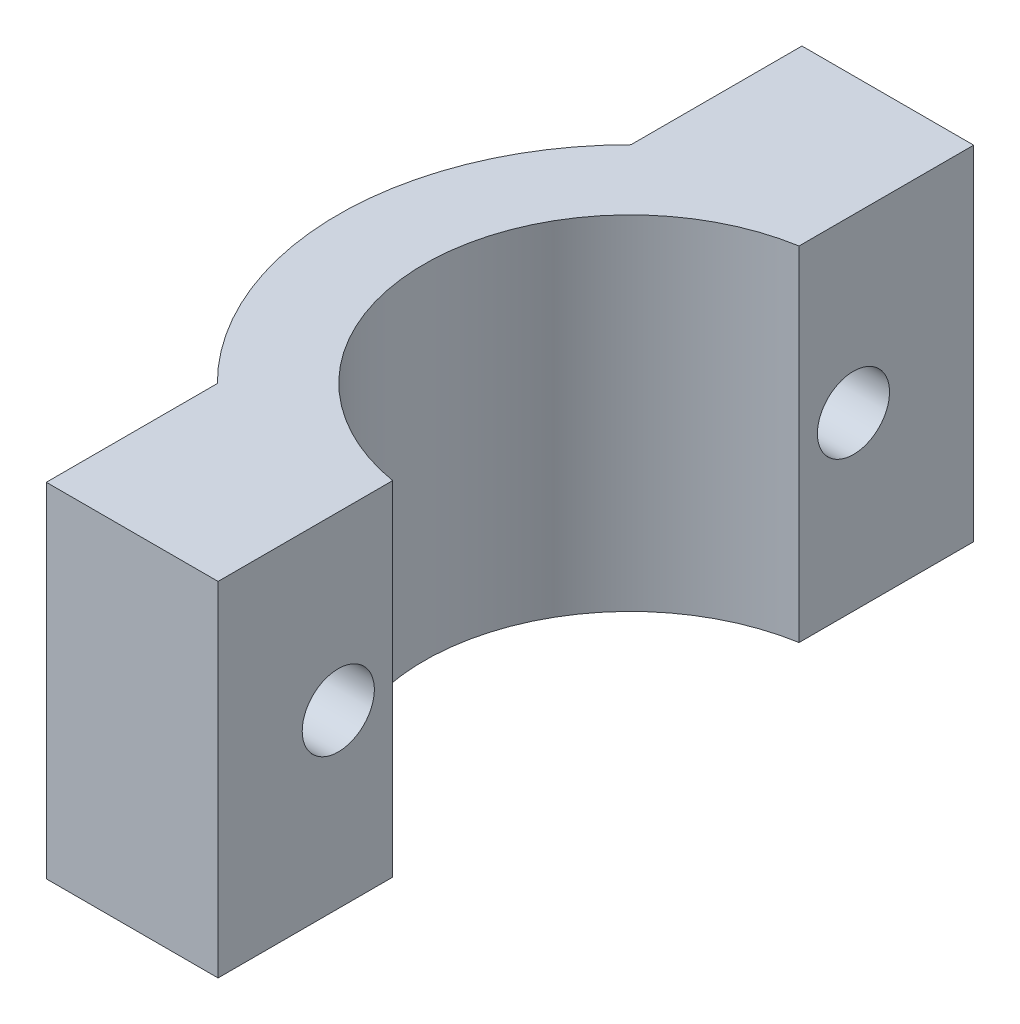
from build123d import *

# Parameters (mm, degrees)
BOSS_EXTRUDE1_DEPTH     = 10
CUT_EXTRUDE1_DEPTH      = 18.12454379
CUT_EXTRUDE1_DEPTH_BACK = 18.12454379
SKETCH2_R               = 1.05
CUT_EXTRUDE2_DEPTH      = 1
CUT_EXTRUDE2_DEPTH_BACK = 10
CUT_EXTRUDE2_START      = -6
SKETCH2_3_R             = 1.75
SKETCH2_3_R_2           = 1.05


with BuildPart() as part:
    # Sketch1 → Boss-Extrude1 (new body)
    with BuildSketch(Plane(origin=(0, 0, 0), x_dir=(1, 0, 0), z_dir=(0, 1, 0))):
        with BuildLine():
            Line((-6, -2.1e-08), (-6, 6.020797289))
            ThreePointArc((-6, 6.020797289), (-8.5, 0), (-6, -6.020797289))
            Line((-6, -6.020797289), (-6, -2.1e-08))
        make_face()
        with BuildLine():
            ThreePointArc((-1, 8.440971508), (-3.703283788, 7.65086199), (-6, 6.020797289))
            Line((-6, 6.020797289), (-6, -2.1e-08))
            ThreePointArc((-6, -2.1e-08), (-4.582575702, 3.872983338), (-1, 5.916079783))
            Line((-1, 5.916079783), (-1, 8.440971508))
        make_face()
        with BuildLine():
            ThreePointArc((-1, -5.916079783), (-4.582575688, -3.872983354), (-6, -2.1e-08))
            Line((-6, -2.1e-08), (-6, -6.020797289))
            ThreePointArc((-6, -6.020797289), (-3.703283788, -7.65086199), (-1, -8.440971508))
            Line((-1, -8.440971508), (-1, -5.916079783))
        make_face()
        with BuildLine():
            ThreePointArc((-1, -8.440971508), (-3.703283788, -7.65086199), (-6, -6.020797289))
            Line((-6, -6.020797289), (-6, -11))
            Line((-6, -11), (-1, -11))
            Line((-1, -11), (-1, -8.440971508))
        make_face()
        with BuildLine():
            Line((-1, 11), (-6, 11))
            Line((-6, 11), (-6, 6.020797289))
            ThreePointArc((-6, 6.020797289), (-3.703283788, 7.65086199), (-1, 8.440971508))
            Line((-1, 8.440971508), (-1, 11))
        make_face()
    extrude(amount=-BOSS_EXTRUDE1_DEPTH)

    # Sketch2 → Cut-Extrude1 (cut, two sides: drawn at the far end of the back side and taken through both)
    with BuildSketch(Plane(origin=(0, 0, 0), x_dir=(0, 0, -1), z_dir=(1, 0, 0)).offset(-CUT_EXTRUDE1_DEPTH_BACK)):
        with Locations(Location((-7.5, -5, 0), (0, 0, 180))):
            Circle(SKETCH2_R)
        with Locations(Location((7.5, -5, 0), (0, 0, 180))):
            Circle(SKETCH2_R)
    extrude(amount=CUT_EXTRUDE1_DEPTH + CUT_EXTRUDE1_DEPTH_BACK, mode=Mode.SUBTRACT)

    # Sketch2<3> → Cut-Extrude2 (cut, two sides: drawn at the far end of the back side and taken through both)
    # profile 1 of 2: a face of its own
    with BuildSketch(Plane(origin=(0, 0, 0), x_dir=(0, 0, -1), z_dir=(1, 0, 0)).offset(CUT_EXTRUDE2_START - CUT_EXTRUDE2_DEPTH_BACK)):
        with Locations(Location((-7.5, -5, 0), (0, 0, 327.699663161))):
            Circle(SKETCH2_3_R)
        with Locations(Location((-7.5, -5, 0), (0, 0, 180))):
            Circle(SKETCH2_3_R_2, mode=Mode.SUBTRACT)
    # profile 2 of 2: a face of its own
    with BuildSketch(Plane(origin=(0, 0, 0), x_dir=(0, 0, -1), z_dir=(1, 0, 0)).offset(CUT_EXTRUDE2_START - CUT_EXTRUDE2_DEPTH_BACK)):
        with Locations(Location((7.5, -5, 0), (0, 0, 212.300336839))):
            Circle(SKETCH2_3_R)
        with Locations(Location((7.5, -5, 0), (0, 0, 180))):
            Circle(SKETCH2_3_R_2, mode=Mode.SUBTRACT)
    extrude(amount=CUT_EXTRUDE2_DEPTH + CUT_EXTRUDE2_DEPTH_BACK, mode=Mode.SUBTRACT)


solid = part.part
